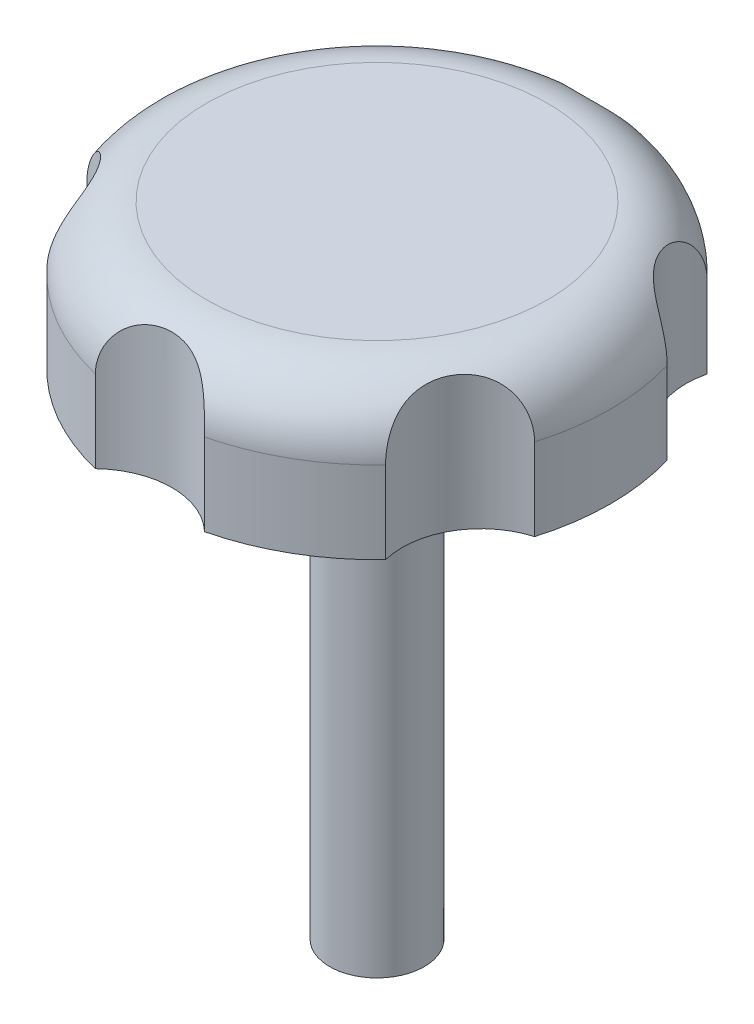
from build123d import *

# Parameters (mm, degrees)
SKETCH_1_R          = 7.35
EXTRUDE_1_DEPTH     = 3.3
SKETCH_2_R          = 3
EXTRUDE_342_DEPTH   = 28
SKETCH_3_R          = 14.8
EXTRUDE_3_DEPTH     = 9.2
FILLET_1_R          = 4
SKETCH_4_R          = 5
CUT_EXTRUDE_1_DEPTH = 10


with BuildPart() as part:
    # Эскиз1 → Бобышка-Вытянуть1 (new body)
    with BuildSketch(Plane(origin=(0, 0, 0), x_dir=(1, 0, 0), z_dir=(0, 1, 0))):
        with Locations(Location((0, 0, 0), (0, 0, 270))):
            Circle(SKETCH_1_R)
    extrude(amount=EXTRUDE_1_DEPTH)

    # Эскиз2 → Extrude 342 (add)
    with BuildSketch(Plane.XZ):
        with Locations(Location((0, 0, 0), (0, 0, 270))):
            Circle(SKETCH_2_R)
    extrude(amount=EXTRUDE_342_DEPTH)

    # Эскиз3 → Бобышка-Вытянуть3 (add)
    with BuildSketch(Plane(origin=(0, 3.3, 0), x_dir=(1, 0, 0), z_dir=(0, 1, 0))):
        with Locations(Location((0, 0, 0), (0, 0, 270))):
            Circle(SKETCH_3_R)
    extrude(amount=EXTRUDE_3_DEPTH)

    # Скругление1
    fillet_1_edges = [part.edges().sort_by_distance(p)[0] for p in [
        (0, 12.5, -14.8),
    ]]
    fillet(fillet_1_edges, radius=FILLET_1_R)

    # Эскиз4 → Вырез-Вытянуть1 (cut)
    with BuildSketch(Plane(origin=(0, 12.5, 0), x_dir=(1, 0, 0), z_dir=(0, 1, 0))):
        with Locations((0, 18)):
            Circle(SKETCH_4_R)
        with Locations((15.588457268, 9)):
            Circle(SKETCH_4_R)
        with Locations((15.588457268, -9)):
            Circle(SKETCH_4_R)
        with Locations((0, -18)):
            Circle(SKETCH_4_R)
        with Locations((-15.588457268, -9)):
            Circle(SKETCH_4_R)
        with Locations((-15.588457268, 9)):
            Circle(SKETCH_4_R)
    extrude(amount=-CUT_EXTRUDE_1_DEPTH, mode=Mode.SUBTRACT)


solid = part.part
